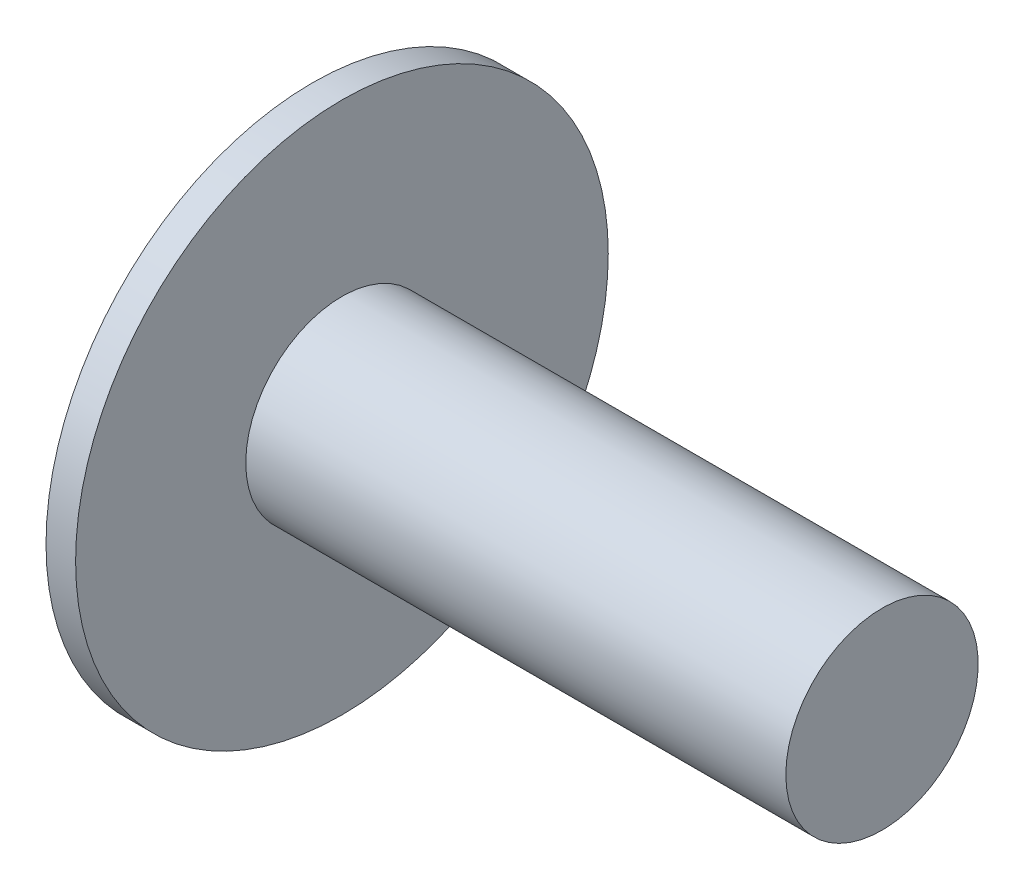
from build123d import *


with BuildPart() as part:
    # Sketch1 → Revolve1 (revolve)
    with BuildSketch(Plane.XY, mode=Mode.PRIVATE) as revolve1_sk:
        Polygon((0, 6.5), (36.5, 6.5), (36.5, 0), (-2, 0), (-2, 18), (0, 18), align=None)
    revolve(revolve1_sk.sketch.rotate(Axis((-29.661319917, 0, 0), (1, 0, 0)), 90), axis=Axis((-29.661319917, 0, 0), (1, 0, 0)))


solid = part.part
